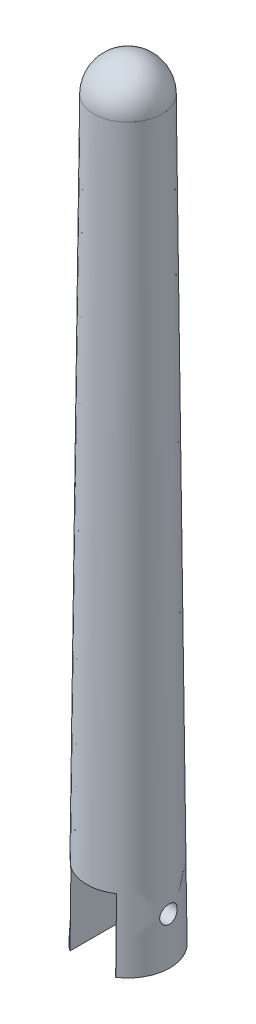
from build123d import *

# Parameters (mm, degrees)
SKETCH1_R               = 4.775
SKETCH2_R               = 3.9
REVOLVE1_ANGLE          = 180
SKETCH4_W               = 10.192590036
SKETCH4_H               = 8.2
CUT_EXTRUDE1_DEPTH      = 2.6
CUT_EXTRUDE2_DEPTH      = 89.188739374
CUT_EXTRUDE2_DEPTH_BACK = 89.188739374
SKETCH5_R               = 1


with BuildPart() as part:
    # Sketch1 → Loft1 section 0
    with BuildSketch(Plane(origin=(0, 0, 0), x_dir=(1, 0, 0), z_dir=(0, 1, 0))):
        Circle(SKETCH1_R)
    # Sketch2 → Loft1 section 1
    with BuildSketch(Plane(origin=(0, 83.85, 0), x_dir=(1, 0, 0), z_dir=(0, 1, 0))):
        Circle(SKETCH2_R)
    loft()

    # Sketch4 → Cut-Extrude1 (cut, symmetric)
    with BuildSketch(Plane(origin=(0, 0, 0), x_dir=(0, 0, -1), z_dir=(1, 0, 0))):
        with Locations((-2.796295018, 4.1)):
            Rectangle(SKETCH4_W, SKETCH4_H)
    extrude(amount=CUT_EXTRUDE1_DEPTH, both=True, mode=Mode.SUBTRACT)

    # Sketch5 → Cut-Extrude2 (cut, two sides: drawn at the far end of the back side and taken through both)
    with BuildSketch(Plane.ZY.offset(-2.6).offset(-CUT_EXTRUDE2_DEPTH_BACK)):
        with Locations((0, 5.3)):
            Circle(SKETCH5_R)
    extrude(amount=CUT_EXTRUDE2_DEPTH + CUT_EXTRUDE2_DEPTH_BACK, mode=Mode.SUBTRACT)


with BuildPart() as body_2:
    # Sketch3 → Revolve1 (revolve)
    with BuildSketch(Plane(origin=(0, 83.85, 0), x_dir=(1, 0, 0), z_dir=(0, 1, 0))):
        with BuildLine():
            Line((0, 3.9), (0, -3.9))
            ThreePointArc((0, -3.9), (-3.9, 0), (0, 3.9))
        make_face()
    revolve(axis=Axis((0, 83.85, -3.9), (0, 0, -1)), revolution_arc=REVOLVE1_ANGLE)


solid = Compound([part.part, body_2.part])
